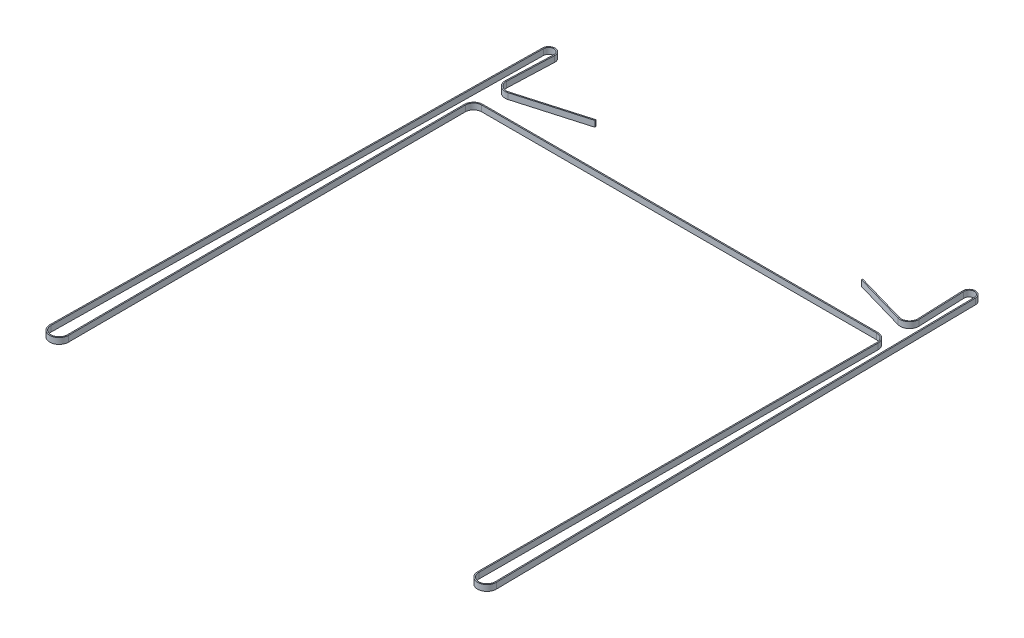
from build123d import *

# Parameters (mm, degrees)
EXTRUDE_THIN1_START = 98.137598
EXTRUDE_THIN1_DEPTH = 6.35


with BuildPart() as part:
    # Sketch1 → Extrude-Thin1 (new body)
    with BuildSketch(Plane(origin=(0, 0, 0), x_dir=(1, 0, 0), z_dir=(0, 1, 0)).offset(EXTRUDE_THIN1_START)):
        with BuildLine():
            Line((400.023485906, -85.443361152), (454.971450984, -101.27596863))
            ThreePointArc((454.971450984, -101.27596863), (463.861362415, -99.548472953), (467.668957804, -91.331601045))
            Line((467.668957804, -91.331601045), (465.755105618, -41.69369751))
            ThreePointArc((465.755105618, -41.69369751), (471.16659983, -35.920320597), (476.872500072, -41.402916061))
            Line((476.872500072, -41.402916061), (484.032084809, -561.613939409))
            ThreePointArc((484.032084809, -561.613939409), (475.331383816, -570.484218666), (466.532944878, -561.710876992))
            Line((466.532944878, -561.710876992), (467.676291292, -135.561743547))
            ThreePointArc((467.676291292, -135.561743547), (464.771471532, -128.508780211), (457.726327103, -125.585048067))
            Line((457.726327103, -125.585048067), (217.954761626, -125.585048067))
            Line((217.954761626, -125.585048067), (34.733672902, -125.585048067))
            ThreePointArc((34.733672902, -125.585048067), (27.688528473, -128.508780211), (24.783708713, -135.561743547))
            Line((24.783708713, -135.561743547), (25.927055127, -561.710876992))
            ThreePointArc((25.927055127, -561.710876992), (17.128616189, -570.484218666), (8.427915196, -561.613939409))
            Line((8.427915196, -561.613939409), (15.587499933, -41.402916061))
            ThreePointArc((15.587499933, -41.402916061), (21.293400175, -35.920320597), (26.704894387, -41.69369751))
            Line((26.704894387, -41.69369751), (24.791042201, -91.331601045))
            ThreePointArc((24.791042201, -91.331601045), (28.59863759, -99.548472953), (37.488549021, -101.27596863))
            Line((37.488549021, -101.27596863), (109.817026065, -80.435371805))
            Line((109.817026065, -80.435371805), (109.4847775, -79.282284258))
            Line((109.4847775, -79.282284258), (37.156300457, -100.122881082))
            ThreePointArc((37.156300457, -100.122881082), (29.338539147, -98.603726593), (25.990151243, -91.377834212))
            Line((25.990151243, -91.377834212), (27.904003429, -41.739930677))
            ThreePointArc((27.904003429, -41.739930677), (21.324776092, -34.720730854), (14.387613566, -41.386402209))
            Line((14.387613566, -41.386402209), (7.22802883, -561.597425557))
            ThreePointArc((7.22802883, -561.597425557), (17.121968816, -571.684200254), (27.127050808, -561.707657437))
            Line((27.127050808, -561.707657437), (25.983704394, -135.558523992))
            ThreePointArc((25.983704394, -135.558523992), (28.538194133, -129.356169299), (34.733672902, -126.785048067))
            Line((34.733672902, -126.785048067), (217.954761626, -126.785048067))
            Line((217.954761626, -126.785048067), (457.726327103, -126.785048067))
            ThreePointArc((457.726327103, -126.785048067), (463.921805872, -129.356169299), (466.476295611, -135.558523992))
            Line((466.476295611, -135.558523992), (465.332949197, -561.707657437))
            ThreePointArc((465.332949197, -561.707657437), (475.338031189, -571.684200254), (485.231971175, -561.597425557))
            Line((485.231971175, -561.597425557), (478.072386439, -41.386402209))
            ThreePointArc((478.072386439, -41.386402209), (471.135223913, -34.720730854), (464.555996576, -41.739930677))
            Line((464.555996576, -41.739930677), (466.469848762, -91.377834212))
            ThreePointArc((466.469848762, -91.377834212), (463.121460857, -98.603726593), (455.303699548, -100.122881082))
            Line((455.303699548, -100.122881082), (400.355734471, -84.290273604))
            Line((400.355734471, -84.290273604), (400.023485906, -85.443361152))
        make_face()
    extrude(amount=EXTRUDE_THIN1_DEPTH)


solid = part.part
